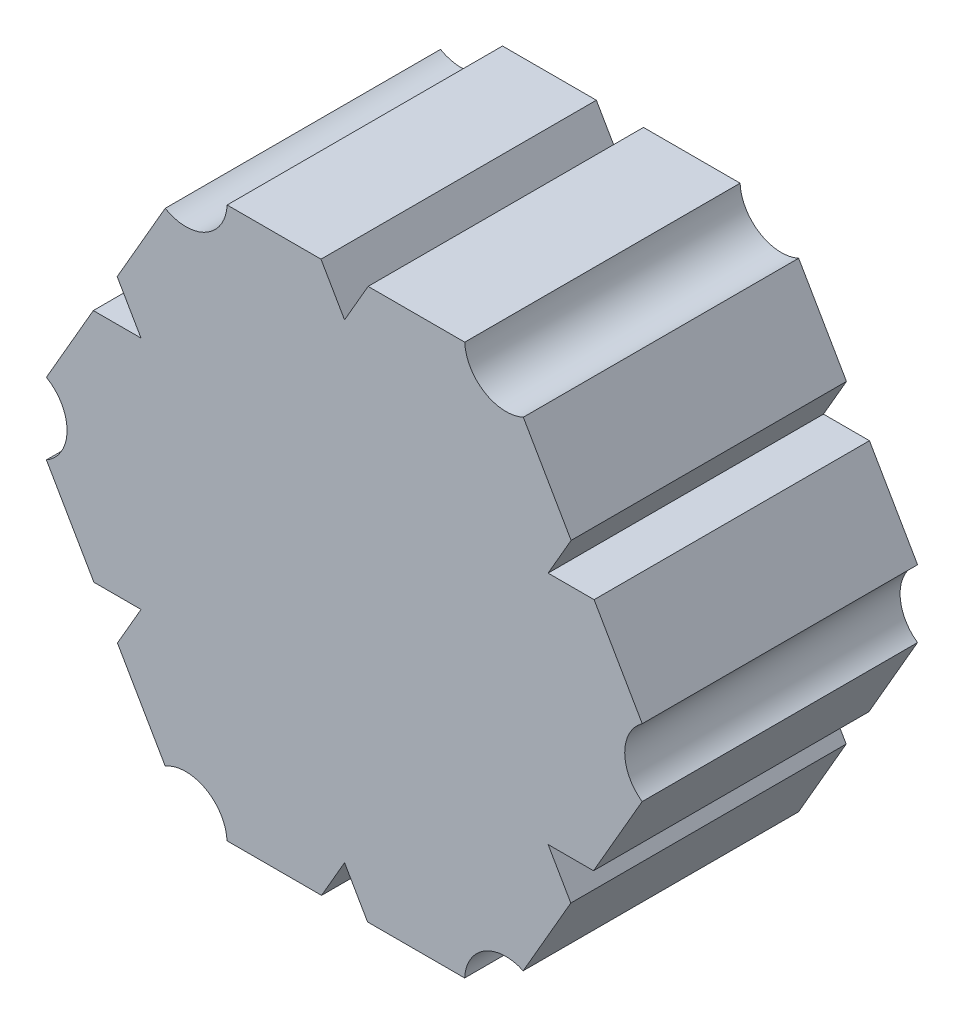
from build123d import *

# Parameters (mm, degrees)
EXTRUDE_1_DEPTH          = 10
CUT_EXTRUDE_1_DEPTH      = 20
PATTERN_CIRCULAR_1_COUNT = 6
SKETCH_3_R               = 3
CUT_EXTRUDE_2_DEPTH      = 20
PATTERN_CIRCULAR_2_COUNT = 6


with BuildPart() as part:
    # 草图1 → 凸台-拉伸1 (new, symmetric)
    with BuildSketch(Plane.XY):
        Polygon((23.094010768, 0), (11.547005384, 20), (-11.547005384, 20), (-23.094010768, 0), (-11.547005384, -20), (11.547005384, -20), align=None)
    extrude(amount=EXTRUDE_1_DEPTH, both=True)

    # 草图2 → 切除-拉伸1 (cut)
    with BuildSketch(Plane.XY.offset(10)):
        Polygon((-14.722431864, 8.5), (-17.320508076, 13), (-19.918584287, 8.5), align=None)
    cut_extrude_1 = extrude(amount=-CUT_EXTRUDE_1_DEPTH, mode=Mode.SUBTRACT)

    # 阵列(圆周)1: 切除-拉伸1 ×6 about axis
    pattern_circular_1_axis = Axis((0.061936572, -0.035759097, 0), (0, 0, 1))
    for i in range(1, PATTERN_CIRCULAR_1_COUNT):
        add(cut_extrude_1.rotate(pattern_circular_1_axis, i * 360 / PATTERN_CIRCULAR_1_COUNT), mode=Mode.SUBTRACT)

    # 草图3 → 切除-拉伸2 (cut)
    with BuildSketch(Plane.XY.offset(10)):
        with Locations((-23.094010768, 0)):
            Circle(SKETCH_3_R)
    cut_extrude_2 = extrude(amount=-CUT_EXTRUDE_2_DEPTH, mode=Mode.SUBTRACT)

    # 阵列(圆周)2: 切除-拉伸2 ×6 about axis
    pattern_circular_2_axis = Axis((0.158034709, -0.00459912, 0), (0, 0, 1))
    for i in range(1, PATTERN_CIRCULAR_2_COUNT):
        add(cut_extrude_2.rotate(pattern_circular_2_axis, i * 360 / PATTERN_CIRCULAR_2_COUNT), mode=Mode.SUBTRACT)


solid = part.part
